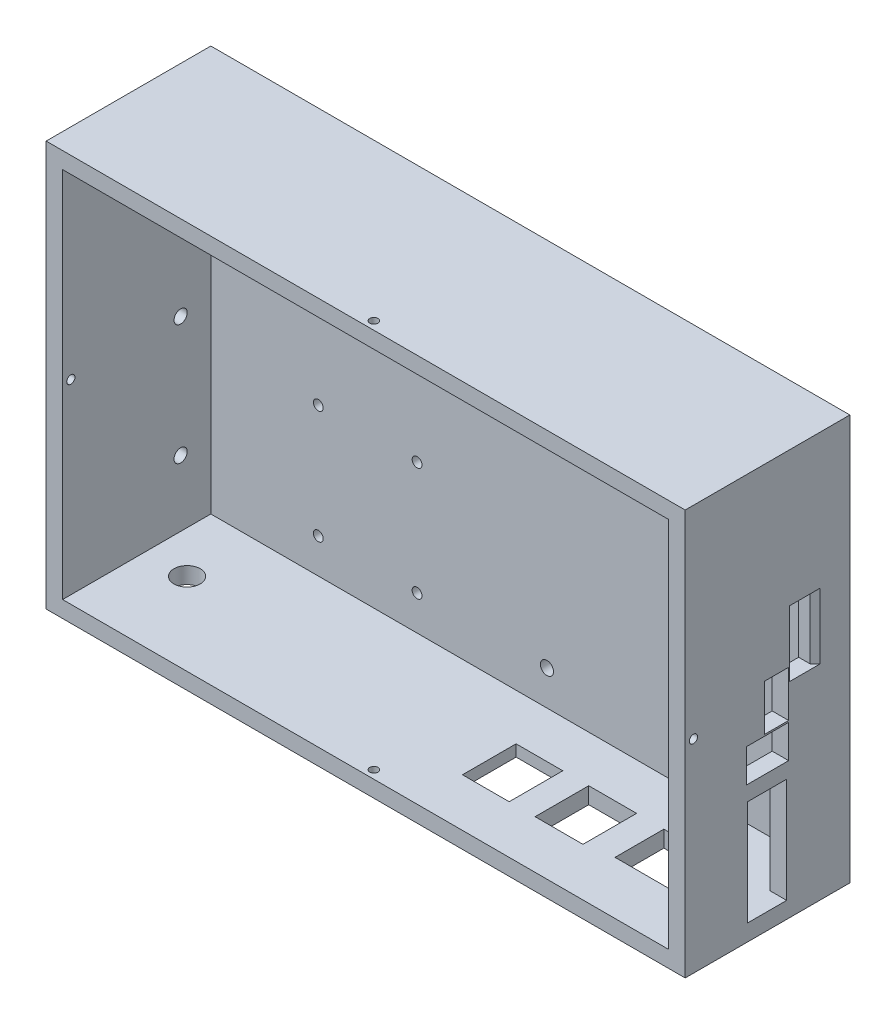
from build123d import *

# Parameters (mm, degrees)
SCHIZZO2_W                   = 194.047297703
SCHIZZO2_H                   = 123.066886556
SCHIZZO2_W_2                 = 184.047297703
SCHIZZO2_H_2                 = 113.066886556
ESTRUSIONE_SOTTILE1_DEPTH    = 45
SCHIZZO3_W                   = 194.047297703
SCHIZZO3_H                   = 123.066886556
ESTRUSIONE_ESTRUSIONE1_DEPTH = 5
SCHIZZO4_R                   = 2
TAGLIO_ESTRUSIONE1_DEPTH     = 5
SMUSSO1_SIZE                 = 1.5
SMUSSO2_SIZE                 = 1.5
SMUSSO3_SIZE                 = 1.5
SMUSSO4_SIZE                 = 1.5
SCHIZZO5_W                   = 7.767621353
SCHIZZO5_H                   = 19.92122066
SCHIZZO5_W_2                 = 7.310576499
SCHIZZO5_H_2                 = 13.99005078
SCHIZZO5_W_3                 = 12.838114045
SCHIZZO5_H_3                 = 10.076749863
SCHIZZO5_W_4                 = 11.950153196
SCHIZZO5_H_4                 = 31.877712984
TAGLIO_ESTRUSIONE2_DEPTH     = 5
SCHIZZO6_W                   = 17.563316518
SCHIZZO6_H                   = 14.837974299
SCHIZZO6_W_2                 = 14.53926904
SCHIZZO6_H_2                 = 16.284185158
SCHIZZO6_W_3                 = 14.178791295
TAGLIO_ESTRUSIONE3_DEPTH     = 5
SMUSSO5_SIZE                 = 1.5
SMUSSO6_SIZE                 = 1.5
SCHIZZO7_R                   = 2
TAGLIO_ESTRUSIONE4_DEPTH     = 5
TAGLIO_ESTRUSIONE5_REACH     = 215.125
SCHIZZO8_R                   = 1.25
TAGLIO_ESTRUSIONE6_REACH     = 198.636
SCHIZZO9_R                   = 1.25
SCHIZZO10_R                  = 1.5
TAGLIO_ESTRUSIONE7_DEPTH     = 10
SCHIZZO11_R                  = 4
TAGLIO_ESTRUSIONE8_DEPTH     = 10


with BuildPart() as part:
    # Schizzo2 → Estrusione-Sottile1 (new body)
    with BuildSketch(Plane.XY.offset(6.703232706)):
        with Locations((-50.100447002, 15.233443278)):
            Rectangle(SCHIZZO2_W, SCHIZZO2_H)
        with Locations((-50.100447002, 15.233443278)):
            Rectangle(SCHIZZO2_W_2, SCHIZZO2_H_2, mode=Mode.SUBTRACT)
    extrude(amount=-ESTRUSIONE_SOTTILE1_DEPTH)

    # Schizzo3 → Estrusione-Estrusione1 (add)
    with BuildSketch(Plane(origin=(0, 0, -38.296767294), x_dir=(-1, 0, 0), z_dir=(0, 0, -1))):
        with Locations((50.100447002, 15.233443278)):
            Rectangle(SCHIZZO3_W, SCHIZZO3_H)
    extrude(amount=ESTRUSIONE_ESTRUSIONE1_DEPTH)

    # Schizzo4 → Taglio-Estrusione1 (cut)
    with BuildSketch(Plane.XY.offset(-38.296767294)):
        with Locations((-40.051479808, 38.040961433)):
            Circle(SCHIZZO4_R)
        with Locations((-40.062752428, -30.759038567)):
            Circle(SCHIZZO4_R)
        with Locations((31.337247572, 38.040961433)):
            Circle(SCHIZZO4_R)
        with Locations((31.337247572, -30.759038567)):
            Circle(SCHIZZO4_R)
    extrude(amount=-TAGLIO_ESTRUSIONE1_DEPTH, mode=Mode.SUBTRACT)

    # Smusso1
    smusso1_edges = [part.edges().sort_by_distance(p)[0] for p in [
        (-42.051479808, 38.040961433, -43.296767294),
    ]]
    chamfer(smusso1_edges, length=SMUSSO1_SIZE)

    # Smusso2
    smusso2_edges = [part.edges().sort_by_distance(p)[0] for p in [
        (29.337247572, 38.040961433, -43.296767294),
    ]]
    chamfer(smusso2_edges, length=SMUSSO2_SIZE)

    # Smusso3
    smusso3_edges = [part.edges().sort_by_distance(p)[0] for p in [
        (29.337247572, -30.759038567, -43.296767294),
    ]]
    chamfer(smusso3_edges, length=SMUSSO3_SIZE)

    # Smusso4
    smusso4_edges = [part.edges().sort_by_distance(p)[0] for p in [
        (-42.062752428, -30.759038567, -43.296767294),
    ]]
    chamfer(smusso4_edges, length=SMUSSO4_SIZE)

    # Schizzo5 → Taglio-Estrusione2 (cut)
    with BuildSketch(Plane(origin=(46.92320185, 0, 0), x_dir=(0, 0, -1), z_dir=(1, 0, 0))):
        with Locations((28.867264407, 25.774079034)):
            Rectangle(SCHIZZO5_W, SCHIZZO5_H)
        with Locations((21.058264637, 12.710451031)):
            Rectangle(SCHIZZO5_W_2, SCHIZZO5_H_2)
        with Locations((18.294495864, 0.187888095)):
            Rectangle(SCHIZZO5_W_3, SCHIZZO5_H_3)
        with Locations((18.13726933, -25.361143508)):
            Rectangle(SCHIZZO5_W_4, SCHIZZO5_H_4)
    extrude(amount=-TAGLIO_ESTRUSIONE2_DEPTH, mode=Mode.SUBTRACT)

    # Schizzo6 → Taglio-Estrusione3 (cut)
    with BuildSketch(Plane.XZ.offset(46.3)):
        with Locations((18.323185023, -16.793891295)):
            Rectangle(SCHIZZO6_W, SCHIZZO6_H)
        with Locations((-6.016266439, -16.070785866)):
            Rectangle(SCHIZZO6_W_2, SCHIZZO6_H_2)
        with Locations((-28.245727369, -16.070785866)):
            Rectangle(SCHIZZO6_W_3, SCHIZZO6_H_2)
    extrude(amount=-TAGLIO_ESTRUSIONE3_DEPTH, mode=Mode.SUBTRACT)

    # Smusso5
    smusso5_edges = [part.edges().sort_by_distance(p)[0] for p in [
        (-35.335123016, -46.3, -16.070785866),
        (-28.245727368, -46.3, -24.212878445),
        (-21.156331721, -46.3, -16.070785866),
        (-28.245727368, -46.3, -7.928693287),
    ]]
    chamfer(smusso5_edges, length=SMUSSO5_SIZE)

    # Smusso6
    smusso6_edges = [part.edges().sort_by_distance(p)[0] for p in [
        (46.92320185, 25.774079034, -32.751075083),
    ]]
    chamfer(smusso6_edges, length=SMUSSO6_SIZE)

    # Schizzo7 → Taglio-Estrusione4 (cut)
    with BuildSketch(Plane.ZY.offset(147.124095853)):
        with Locations((-29.134697753, 51.766886556)):
            Circle(SCHIZZO7_R)
        with Locations((-29.134697753, 15.233443278)):
            Circle(SCHIZZO7_R)
        with Locations((-29.134697753, -21.3)):
            Circle(SCHIZZO7_R)
    extrude(amount=-TAGLIO_ESTRUSIONE4_DEPTH, mode=Mode.SUBTRACT)

    # Schizzo8 → Taglio-Estrusione5 (cut, up to next)
    with BuildSketch(Plane.ZY.offset(147.124095853), mode=Mode.PRIVATE) as taglio_estrusione5_sk1:
        with Locations((4.203232706, 15.309766732)):
            Circle(SCHIZZO8_R)
    taglio_estrusione5_tool1 = extrude(taglio_estrusione5_sk1.sketch, amount=-TAGLIO_ESTRUSIONE5_REACH, mode=Mode.PRIVATE) & part.part
    add(taglio_estrusione5_tool1.solids().sort_by_distance((-147.124096, 15.309767, 4.203233))[0], mode=Mode.SUBTRACT)
    add(taglio_estrusione5_tool1.solids().sort_by_distance((-147.124096, 15.309767, 4.203233))[1], mode=Mode.SUBTRACT)

    # Schizzo9 → Taglio-Estrusione6 (cut, up to next)
    with BuildSketch(Plane.XZ.offset(46.3), mode=Mode.PRIVATE) as taglio_estrusione6_sk1:
        with Locations(Location((-50.100447002, 4.203232706, 0), (0, 0, 270))):
            Circle(SCHIZZO9_R)
    taglio_estrusione6_tool1 = extrude(taglio_estrusione6_sk1.sketch, amount=-TAGLIO_ESTRUSIONE6_REACH, mode=Mode.PRIVATE) & part.part
    add(taglio_estrusione6_tool1.solids().sort_by_distance((-50.100447, -46.3, 4.203233))[0], mode=Mode.SUBTRACT)
    add(taglio_estrusione6_tool1.solids().sort_by_distance((-50.100447, -46.3, 4.203233))[1], mode=Mode.SUBTRACT)

    # Schizzo10 → Taglio-Estrusione7 (cut)
    with BuildSketch(Plane(origin=(0, 0, -43.296767294), x_dir=(-1, 0, 0), z_dir=(0, 0, -1))):
        with Locations((79.486260937, 38.040961433)):
            Circle(SCHIZZO10_R)
        with Locations((109.486260937, 38.040961433)):
            Circle(SCHIZZO10_R)
        with Locations((109.486260937, -30.759038567)):
            Circle(SCHIZZO10_R)
        with Locations((79.486260937, -30.759038567)):
            Circle(SCHIZZO10_R)
        with Locations((109.486260937, 3.640961433)):
            Circle(SCHIZZO10_R)
        with Locations((79.486260937, 3.640961433)):
            Circle(SCHIZZO10_R)
    extrude(amount=-TAGLIO_ESTRUSIONE7_DEPTH, mode=Mode.SUBTRACT)

    # Schizzo11 → Taglio-Estrusione8 (cut)
    with BuildSketch(Plane.XZ.offset(46.3)):
        with Locations(Location((-129.330552929, -18.296767294, 0), (0, 0, 270))):
            Circle(SCHIZZO11_R)
    extrude(amount=-TAGLIO_ESTRUSIONE8_DEPTH, mode=Mode.SUBTRACT)


solid = part.part
